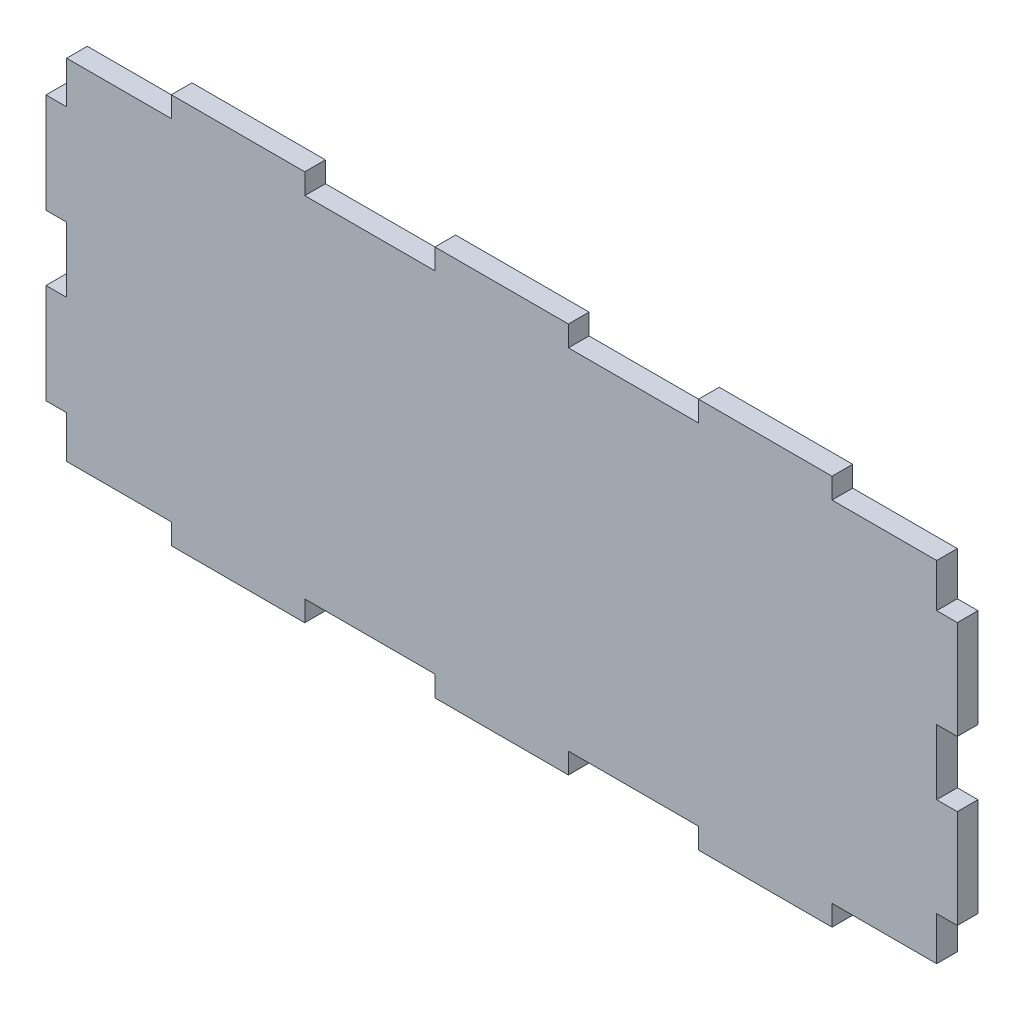
from build123d import *

# Parameters (mm, degrees)
SKETCH1_W           = 140
SKETCH1_H           = 60
BOSS_EXTRUDE1_DEPTH = 3.175
SKETCH2_W           = 20
SKETCH2_H           = 3.175
SKETCH2_W_2         = 3.175
SKETCH2_H_2         = 10
CUT_EXTRUDE1_DEPTH  = 3.175


with BuildPart() as part:
    # Sketch1 → Boss-Extrude1 (new body)
    with BuildSketch(Plane.XY):
        with Locations((5.981871877, 26.825)):
            Rectangle(SKETCH1_W, SKETCH1_H)
    extrude(amount=-BOSS_EXTRUDE1_DEPTH)

    # Sketch2 → Cut-Extrude1 (cut)
    with BuildSketch(Plane.XY):
        Polygon((-60.843128123, 0), (-44.768128123, 0), (-44.768128123, -3.175), (-64.018128123, -3.175), (-64.018128123, 0), (-64.018128123, 6.475), (-60.843128123, 6.475), align=None)
        Polygon((56.731871877, 0), (72.806871877, 0), (72.806871877, 6.675), (75.981871877, 6.675), (75.981871877, 0), (75.981871877, -3.175), (56.731871877, -3.175), align=None)
        Polygon((75.981871877, 46.975), (75.981871877, 53.65), (75.981871877, 56.825), (56.731871877, 56.825), (56.731871877, 53.65), (72.806871877, 53.65), (72.806871877, 46.975), align=None)
        with Locations((26.231871877, 55.2375)):
            Rectangle(SKETCH2_W, SKETCH2_H)
        with Locations((-14.268128123, 55.2375)):
            Rectangle(SKETCH2_W, SKETCH2_H)
        Polygon((-64.018128123, 56.825), (-64.018128123, 53.65), (-64.018128123, 47.175), (-60.843128123, 47.175), (-60.843128123, 53.65), (-44.768128123, 53.65), (-44.768128123, 56.825), align=None)
        with Locations((74.394371877, 26.825)):
            Rectangle(SKETCH2_W_2, SKETCH2_H_2)
        with Locations((-62.430628123, 26.825)):
            Rectangle(SKETCH2_W_2, SKETCH2_H_2)
        with Locations((-14.268128123, -1.5875)):
            Rectangle(SKETCH2_W, SKETCH2_H)
        with Locations((26.231871877, -1.5875)):
            Rectangle(SKETCH2_W, SKETCH2_H)
    extrude(amount=-CUT_EXTRUDE1_DEPTH, mode=Mode.SUBTRACT)


solid = part.part
